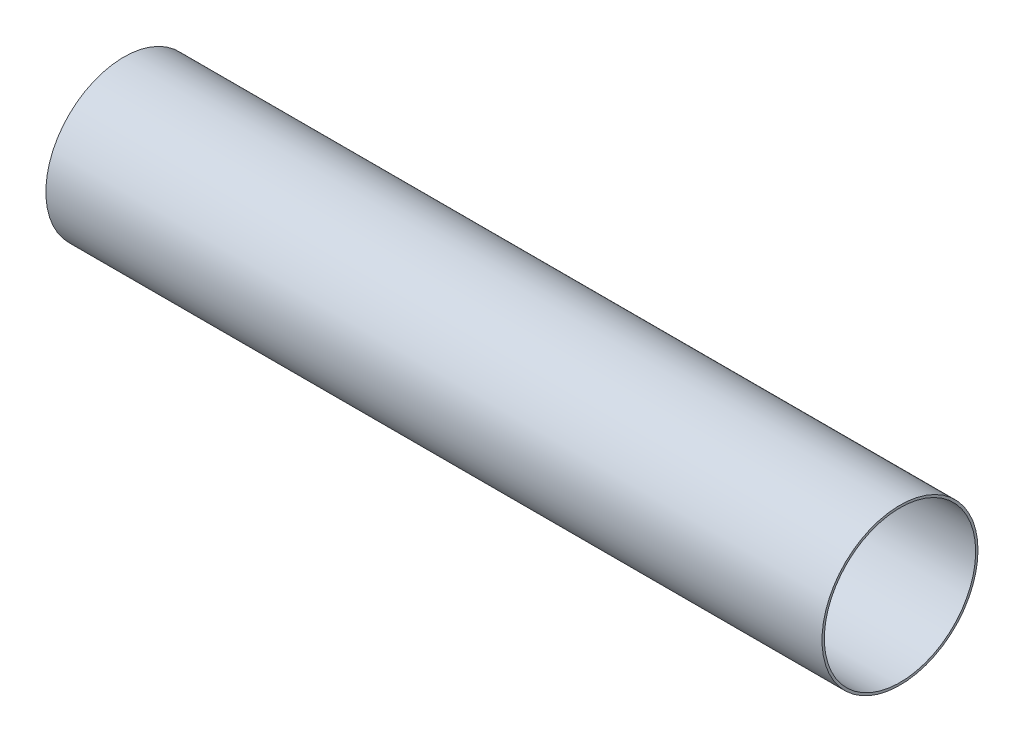
from build123d import *

# Parameters (mm, degrees)
SKETCH1_R           = 51.054
SKETCH1_R_2         = 49.53
BOSS_EXTRUDE1_DEPTH = 508


with BuildPart() as part:
    # Sketch1 → Boss-Extrude1 (new body)
    with BuildSketch(Plane.YZ):
        with Locations(Location((0, 0, 0), (0, 0, 270))):
            Circle(SKETCH1_R)
        with Locations(Location((0, 0, 0), (0, 0, 270))):
            Circle(SKETCH1_R_2, mode=Mode.SUBTRACT)
    extrude(amount=BOSS_EXTRUDE1_DEPTH)


solid = part.part
